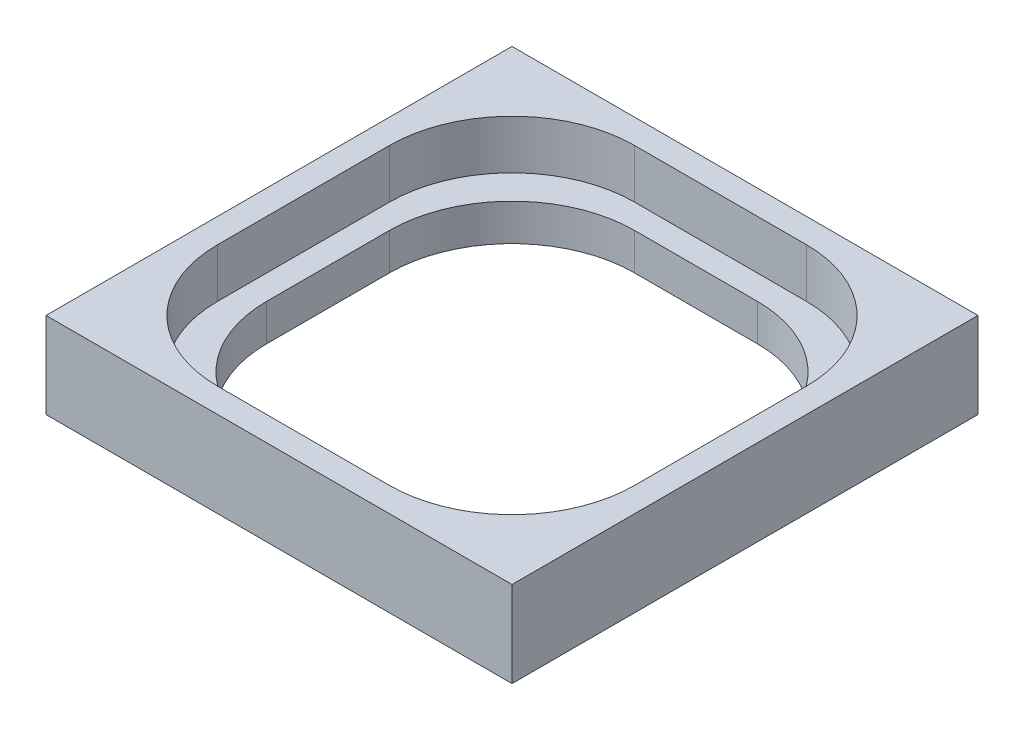
from build123d import *

# Parameters (mm, degrees)
SKETCH1_W           = 38
SKETCH1_H           = 38
BOSS_EXTRUDE1_DEPTH = 3
SKETCH2_W           = 38
SKETCH2_H           = 38
BOSS_EXTRUDE2_DEPTH = 4


with BuildPart() as part:
    # Sketch1 → Boss-Extrude1 (new body)
    with BuildSketch(Plane(origin=(0, 0, 0), x_dir=(1, 0, 0), z_dir=(0, 1, 0))):
        with Locations((19, 19)):
            Rectangle(SKETCH1_W, SKETCH1_H)
        with BuildLine():
            Line((14, 34), (24, 34))
            ThreePointArc((24, 34), (31.071067812, 31.071067812), (34, 24))
            Line((34, 24), (34, 14))
            ThreePointArc((34, 14), (31.071067812, 6.928932188), (24, 4))
            Line((24, 4), (14, 4))
            ThreePointArc((14, 4), (6.928932188, 6.928932188), (4, 14))
            Line((4, 14), (4, 24))
            ThreePointArc((4, 24), (6.928932188, 31.071067812), (14, 34))
        make_face(mode=Mode.SUBTRACT)
    extrude(amount=BOSS_EXTRUDE1_DEPTH)

    # Sketch2 → Boss-Extrude2 (add)
    with BuildSketch(Plane(origin=(0, 3, 0), x_dir=(1, 0, 0), z_dir=(0, 1, 0))):
        with Locations((19, 19)):
            Rectangle(SKETCH2_W, SKETCH2_H)
        with BuildLine():
            Line((12, 36), (26, 36))
            ThreePointArc((26, 36), (33.071067812, 33.071067812), (36, 26))
            Line((36, 26), (36, 12))
            ThreePointArc((36, 12), (33.071067812, 4.928932188), (26, 2))
            Line((26, 2), (12, 2))
            ThreePointArc((12, 2), (4.928932188, 4.928932188), (2, 12))
            Line((2, 12), (2, 26))
            ThreePointArc((2, 26), (4.928932188, 33.071067812), (12, 36))
        make_face(mode=Mode.SUBTRACT)
    extrude(amount=BOSS_EXTRUDE2_DEPTH)


solid = part.part
